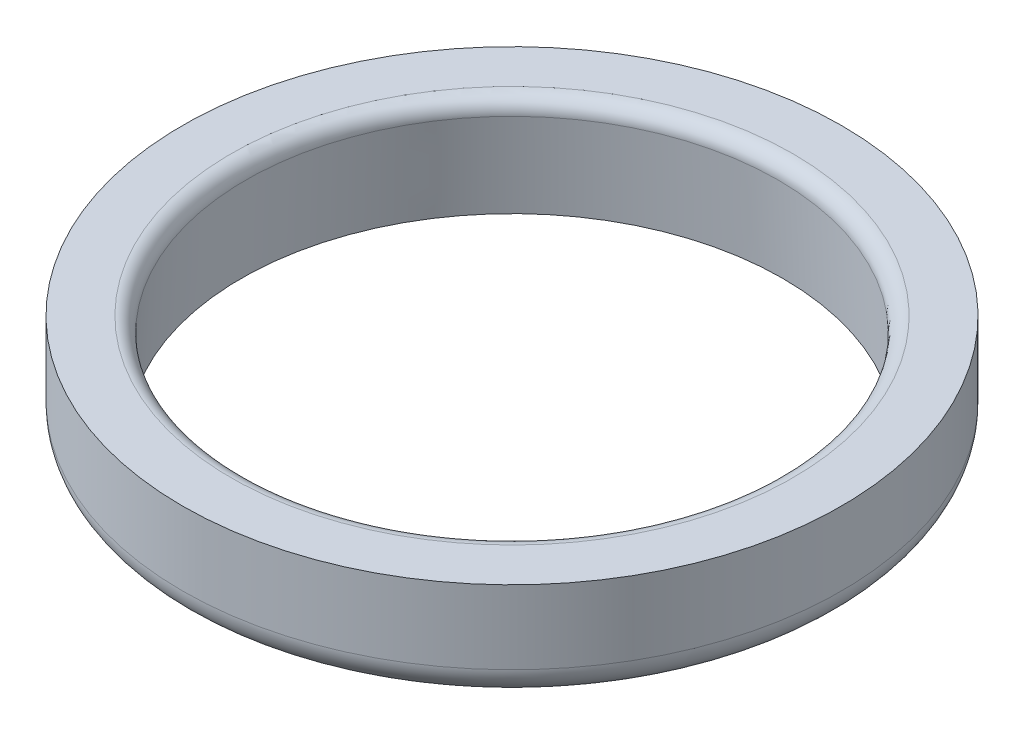
from build123d import *

# Parameters (mm, degrees)
FILLET1_R = 0.5
FILLET2_R = 0.25


with BuildPart() as part:
    # Sketch1 → Revolve1 (revolve)
    with BuildSketch(Plane.XY, mode=Mode.PRIVATE) as revolve1_sk:
        Polygon((-4.6, 0.139049855), (-4.508286386, 1.889049855), (-4.6, 1.889049855), (-5.6, 1.889049855), (-5.6, 0.139049855), align=None)
    revolve(revolve1_sk.sketch.rotate(Axis((0, 0, 0), (0, 1, 0)), 270), axis=Axis((0, 0, 0), (0, 1, 0)))

    # Fillet1
    fillet1_edges = [part.edges().sort_by_distance(p)[0] for p in [
        (0, 0.139049855, 5.6),
    ]]
    fillet(fillet1_edges, radius=FILLET1_R)

    # Fillet2
    fillet2_edges = [part.edges().sort_by_distance(p)[0] for p in [
        (0, 1.889049855, 4.508286386),
    ]]
    fillet(fillet2_edges, radius=FILLET2_R)


solid = part.part
